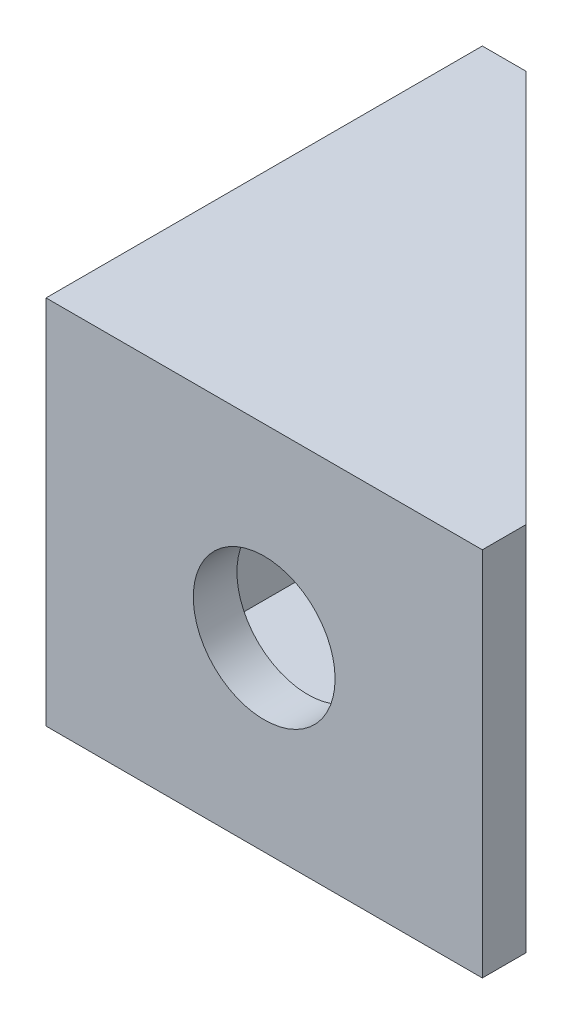
from build123d import *

# Parameters (mm, degrees)
SKETCH1_W           = 20
SKETCH1_H           = 17
SKETCH1_R           = 3.25
BOSS_EXTRUDE1_DEPTH = 2
SKETCH2_W           = 20
SKETCH2_H           = 17
SKETCH2_R           = 3.25
BOSS_EXTRUDE2_DEPTH = 2
BOSS_EXTRUDE3_DEPTH = 2
BOSS_EXTRUDE4_DEPTH = 2


with BuildPart() as part:
    # Sketch1 → Boss-Extrude1 (new body)
    with BuildSketch(Plane.XY):
        with Locations((10, 8.5)):
            Rectangle(SKETCH1_W, SKETCH1_H)
        with Locations((10, 8.5)):
            Circle(SKETCH1_R, mode=Mode.SUBTRACT)
    extrude(amount=-BOSS_EXTRUDE1_DEPTH)

    # Sketch2 → Boss-Extrude2 (add)
    with BuildSketch(Plane(origin=(0, 0, 0), x_dir=(0, 0, -1), z_dir=(1, 0, 0))):
        with Locations((10, 8.5)):
            Rectangle(SKETCH2_W, SKETCH2_H)
        with Locations((10, 8.5)):
            Circle(SKETCH2_R, mode=Mode.SUBTRACT)
    extrude(amount=BOSS_EXTRUDE2_DEPTH)

    # Sketch3 → Boss-Extrude3 (add)
    with BuildSketch(Plane(origin=(0, 17, 0), x_dir=(1, 0, 0), z_dir=(0, 1, 0))):
        Polygon((2, 20), (20, 2), (2, 2), align=None)
    extrude(amount=-BOSS_EXTRUDE3_DEPTH)

    # Sketch4 → Boss-Extrude4 (add)
    with BuildSketch(Plane.XZ):
        Polygon((2, -20), (20, -2), (2, -2), align=None)
    extrude(amount=-BOSS_EXTRUDE4_DEPTH)


solid = part.part
